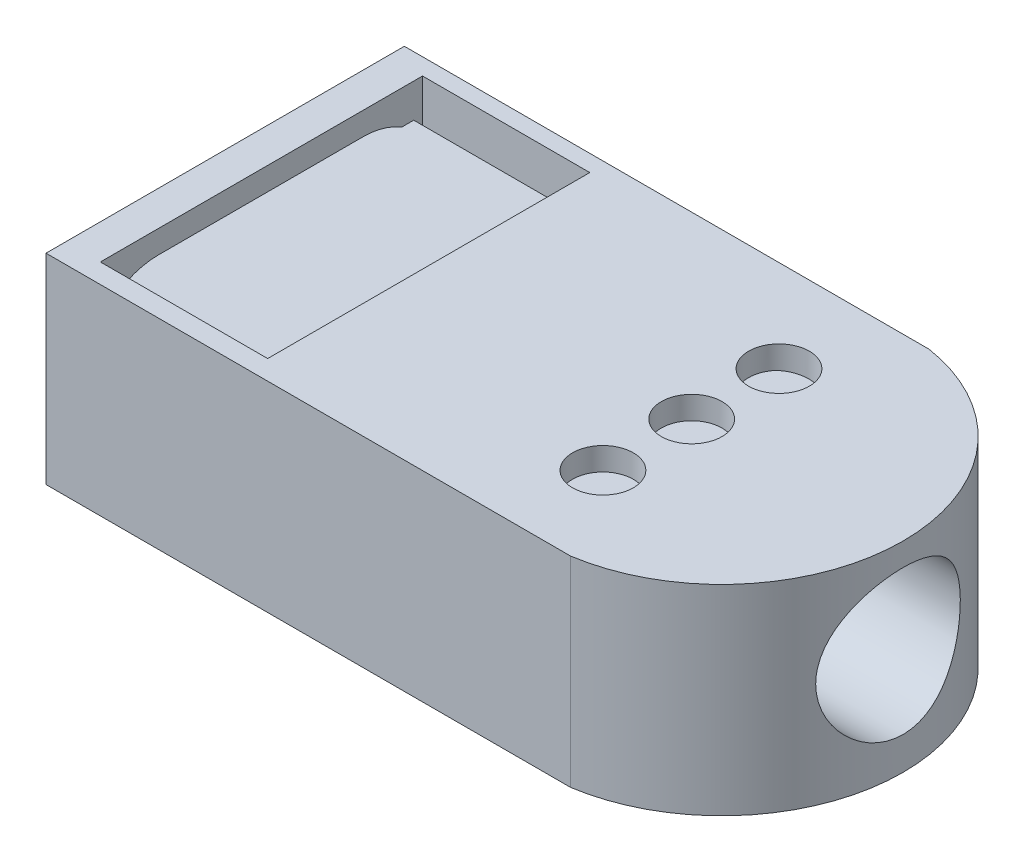
from build123d import *

# Parameters (mm, degrees)
SKETCH_4_W          = 50.742886584
SKETCH_4_H          = 35.769575788
EXTRUDE_3_DEPTH     = 20
CUT_EXTRUDE_1_DEPTH = 48
SKETCH_6_R          = 7.216894088
CUT_EXTRUDE_2_DEPTH = 68
SKETCH_7_W          = 16.696122742
SKETCH_7_H          = 32.152795324
CUT_EXTRUDE_4_DEPTH = 5
SKETCH_8_R          = 3.029228208
SKETCH_8_R_2        = 3.03
SKETCH_8_R_3        = 3.03083806
CUT_EXTRUDE_5_DEPTH = 3
SKETCH_9_W          = 5.030083898
SKETCH_9_H          = 0.631944611
SKETCH_9_W_2        = 7.178609771
SKETCH_9_H_2        = 0.710937687
SKETCH_9_W_3        = 7.570466712
EXTRUDE_5_DEPTH     = 48
SKETCH_10_W         = 27.632027184
SKETCH_10_H         = 0.724840375
SKETCH_10_H_2       = 0.710937687
SKETCH_10_H_3       = 0.631944611
EXTRUDE_6_DEPTH     = 48
SKETCH_13_W         = 1.627827619
SKETCH_13_H         = 35.769575788
EXTRUDE_9_DEPTH     = 20
SKETCH_15_W         = 1.627827619
SKETCH_15_H         = 32.092623512
EXTRUDE_11_DEPTH    = 20
SCALE_1_SCALE       = 2.16174


with BuildPart() as part:
    # 草图4 → 凸台-拉伸3 (new body)
    with BuildSketch(Plane(origin=(0, 0, 0), x_dir=(1, 0, 0), z_dir=(0, 1, 0))):
        Rectangle(SKETCH_4_W, SKETCH_4_H)
        with BuildLine():
            ThreePointArc((25.371443292, 17.884787894), (40.657584716, 0), (25.371443292, -17.884787894))
            Line((25.371443292, -17.884787894), (25.371443292, 17.884787894))
        make_face()
    extrude(amount=EXTRUDE_3_DEPTH)

    # 草图5 → 切除-拉伸1 (cut)
    with BuildSketch(Plane.ZY.offset(25.371443292)):
        with BuildLine():
            Line((-10.314321182, 17.711089067), (10.156549539, 17.711089067))
            ThreePointArc((10.156549539, 17.711089067), (17.33515931, 10.532479296), (10.156549539, 3.353869525))
            Line((10.156549539, 3.353869525), (-10.314321182, 3.353869525))
            ThreePointArc((-10.314321182, 3.353869525), (-17.492930953, 10.532479296), (-10.314321182, 17.711089067))
        make_face()
    extrude(amount=-CUT_EXTRUDE_1_DEPTH, mode=Mode.SUBTRACT)

    # 草图6 → 切除-拉伸2 (cut)
    with BuildSketch(Plane.ZY.offset(25.371443292)):
        with Locations((0, 10.493036385)):
            Circle(SKETCH_6_R)
    extrude(amount=-CUT_EXTRUDE_2_DEPTH, mode=Mode.SUBTRACT)

    # 草图7 → 切除-拉伸4 (cut)
    with BuildSketch(Plane(origin=(0, 20, 0), x_dir=(1, 0, 0), z_dir=(0, 1, 0))):
        with Locations((-15.177393996, 0.145817666)):
            Rectangle(SKETCH_7_W, SKETCH_7_H)
    extrude(amount=-CUT_EXTRUDE_4_DEPTH, mode=Mode.SUBTRACT)

    # 草图8 → 切除-拉伸5 (cut)
    with BuildSketch(Plane(origin=(0, 20, 0), x_dir=(1, 0, 0), z_dir=(0, 1, 0))):
        with Locations(Location((19.563664897, 0, 0), (0, 0, 270))):
            Circle(SKETCH_8_R)
        with Locations(Location((19.563664897, 8.712605536, 0), (0, 0, 270))):
            Circle(SKETCH_8_R_2)
        with Locations(Location((19.563664897, -8.858423201, 0), (0, 0, 270))):
            Circle(SKETCH_8_R_3)
    extrude(amount=-CUT_EXTRUDE_5_DEPTH, mode=Mode.SUBTRACT)

    # 草图9 → 凸台-拉伸5 (add)
    with BuildSketch(Plane.ZY.offset(25.371443292)):
        with Locations((-12.829363131, 16.299697839)):
            Rectangle(SKETCH_9_W, SKETCH_9_H)
        with Locations((-13.903626068, 13.929905549)):
            Rectangle(SKETCH_9_W_2, SKETCH_9_H_2)
        with Locations((-14.099554538, 11.402127105)):
            Rectangle(SKETCH_9_W_3, SKETCH_9_H_2)
    extrude(amount=-EXTRUDE_5_DEPTH)

    # 草图10 → 凸台-拉伸6 (add)
    with BuildSketch(Plane.ZY.offset(25.371443292)):
        with Locations((3.50169241, 11.395175762)):
            Rectangle(SKETCH_10_W, SKETCH_10_H)
        with Locations((3.50169241, 13.929905549)):
            Rectangle(SKETCH_10_W, SKETCH_10_H_2)
        with Locations((3.50169241, 16.299697839)):
            Rectangle(SKETCH_10_W, SKETCH_10_H_3)
    extrude(amount=-EXTRUDE_6_DEPTH)

    # 草图13 → 凸台-拉伸9 (add)
    with BuildSketch(Plane(origin=(0, 20, 0), x_dir=(1, 0, 0), z_dir=(0, 1, 0))):
        with Locations((-26.185357102, 0)):
            Rectangle(SKETCH_13_W, SKETCH_13_H)
    extrude(amount=-EXTRUDE_9_DEPTH)

    # 草图15 → 凸台-拉伸11 (add, through all)
    with BuildSketch(Plane(origin=(0, 20, 0), x_dir=(1, 0, 0), z_dir=(0, 1, 0))):
        with Locations((-26.185357102, 0.07480798)):
            Rectangle(SKETCH_15_W, SKETCH_15_H)
    extrude(amount=-EXTRUDE_11_DEPTH)


with BuildPart() as part_1:
    # 缩放比例1: scaled about (8.140035626, 9.333116532, 0.085734306)
    add(part.part.scale(SCALE_1_SCALE).moved(Location((-9.456604988, -10.8426548, -0.099600973))))


solid = part_1.part
